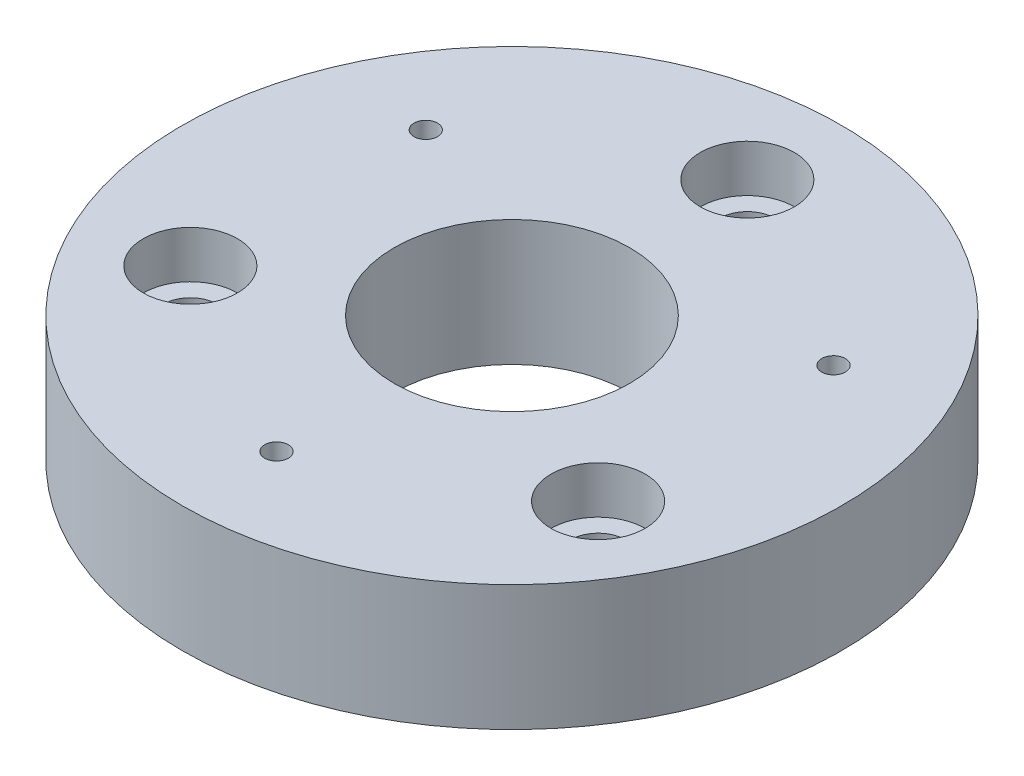
from build123d import *

# Parameters (mm, degrees)
SKETCH1_R           = 21
SKETCH1_R_2         = 1.75
SKETCH1_R_3         = 0.75
SKETCH1_R_4         = 7.5
BOSS_EXTRUDE1_DEPTH = 8
SKETCH2_R           = 3
CUT_EXTRUDE1_DEPTH  = 3


with BuildPart() as part:
    # Sketch1 → Boss-Extrude1 (new body)
    with BuildSketch(Plane(origin=(0, 0, 0), x_dir=(1, 0, 0), z_dir=(0, 1, 0))):
        with Locations(Location((0, 0, 0), (0, 0, 270))):
            Circle(SKETCH1_R)
        with Locations(Location((0, 15, 0), (0, 0, 270))):
            Circle(SKETCH1_R_2, mode=Mode.SUBTRACT)
        with Locations(Location((0, -15, 0), (0, 0, 270))):
            Circle(SKETCH1_R_3, mode=Mode.SUBTRACT)
        with Locations(Location((12.990381057, -7.5, 0), (0, 0, 270))):
            Circle(SKETCH1_R_2, mode=Mode.SUBTRACT)
        with Locations(Location((-12.990381057, -7.5, 0), (0, 0, 270))):
            Circle(SKETCH1_R_2, mode=Mode.SUBTRACT)
        with Locations(Location((-12.990381057, 7.5, 0), (0, 0, 270))):
            Circle(SKETCH1_R_3, mode=Mode.SUBTRACT)
        with Locations(Location((12.990381057, 7.5, 0), (0, 0, 270))):
            Circle(SKETCH1_R_3, mode=Mode.SUBTRACT)
        with Locations(Location((0, 0, 0), (0, 0, 270))):
            Circle(SKETCH1_R_4, mode=Mode.SUBTRACT)
    extrude(amount=BOSS_EXTRUDE1_DEPTH)

    # Sketch2 → Cut-Extrude1 (cut)
    with BuildSketch(Plane(origin=(0, 8, 0), x_dir=(1, 0, 0), z_dir=(0, 1, 0))):
        with Locations(Location((0, 15, 0), (0, 0, 270))):
            Circle(SKETCH2_R)
        with Locations(Location((12.990381057, -7.5, 0), (0, 0, 270))):
            Circle(SKETCH2_R)
        with Locations(Location((-12.990381057, -7.5, 0), (0, 0, 270))):
            Circle(SKETCH2_R)
    extrude(amount=-CUT_EXTRUDE1_DEPTH, mode=Mode.SUBTRACT)


solid = part.part
